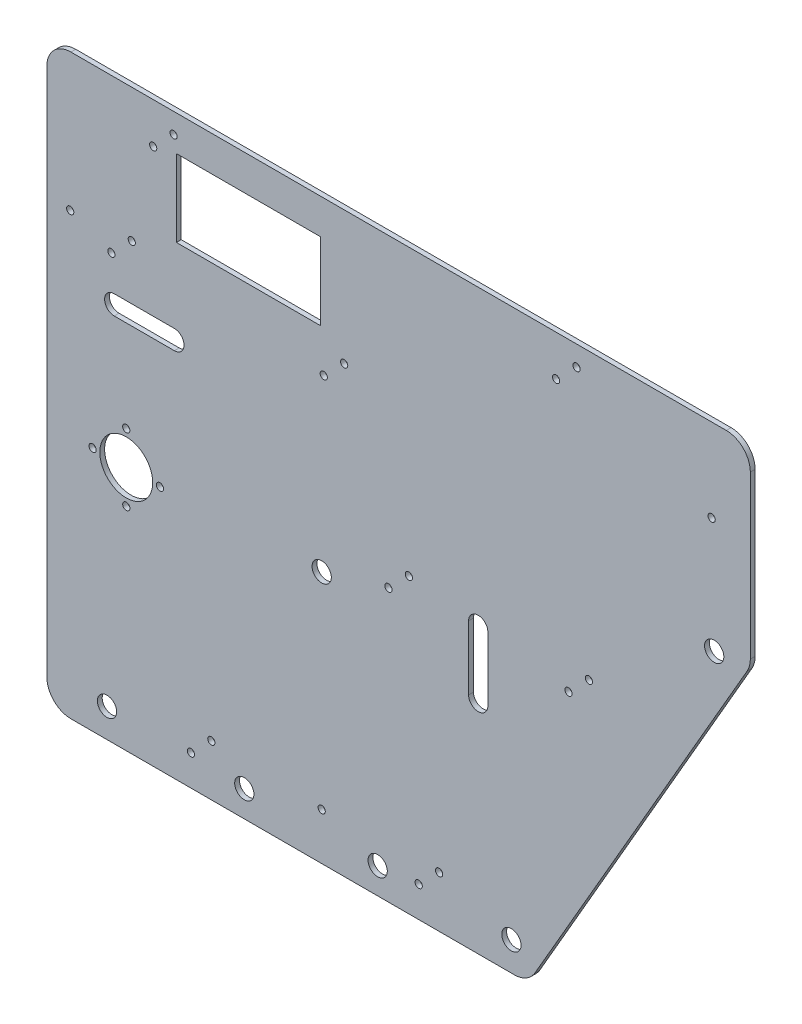
from build123d import *

# Parameters (mm, degrees)
SKETCH1_W           = 200
SKETCH1_H           = 160
SKETCH1_W_2         = 292.37604307
SKETCH1_H_2         = 30
BOSS_EXTRUDE1_DEPTH = 2
SKETCH2_R           = 4
SKETCH2_R_2         = 11
SKETCH2_R_3         = 1.5
CUT_EXTRUDE1_DEPTH  = 3
SKETCH4_W           = 292.37604307
SKETCH4_H           = 50
BOSS_EXTRUDE2_DEPTH = 2
FILLET1_R           = 10
SKETCH5_R           = 1.5
SKETCH5_W           = 60
SKETCH5_H           = 32
CUT_EXTRUDE2_DEPTH  = 11


with BuildPart() as part:
    # Sketch1 → Boss-Extrude1 (new body)
    with BuildSketch(Plane.XY):
        Rectangle(SKETCH1_W, SKETCH1_H)
        Polygon((192.37604307, 80), (100, -80), (100, 80), align=None)
        with Locations((46.188021535, 95)):
            Rectangle(SKETCH1_W_2, SKETCH1_H_2)
    extrude(amount=BOSS_EXTRUDE1_DEPTH)

    # Sketch2 → Cut-Extrude1 (cut)
    with BuildSketch(Plane.XY.offset(2)):
        with Locations((93.07179677, -68)):
            Circle(SKETCH2_R)
        with Locations((177.364936071, 78)):
            Circle(SKETCH2_R)
        with Locations((-67, 22)):
            Circle(SKETCH2_R_2)
        with Locations((-75, -68)):
            Circle(SKETCH2_R)
        with Locations((-53, 22)):
            Circle(SKETCH2_R_3)
        with Locations((-67, 36)):
            Circle(SKETCH2_R_3)
        with Locations((-81, 22)):
            Circle(SKETCH2_R_3)
        with Locations((-67, 8)):
            Circle(SKETCH2_R_3)
        with Locations((54.54952947, -67.242640687)):
            Circle(SKETCH2_R_3)
        with Locations((63.034810844, -58.757359313)):
            Circle(SKETCH2_R_3)
        with Locations((14.225855729, -60.5)):
            Circle(SKETCH2_R_3)
        with Locations((-40.127135228, -67.242640687)):
            Circle(SKETCH2_R_3)
        with Locations((-31.641853854, -58.757359313)):
            Circle(SKETCH2_R_3)
        with Locations((-90.295627115, 102.881439108)):
            Circle(SKETCH2_R_3)
        with Locations((-73.186266887, 96.138798421)):
            Circle(SKETCH2_R_3)
        with Locations((-64.700985513, 104.624079796)):
            Circle(SKETCH2_R_3)
        with Locations((15.078196993, 96.138798421)):
            Circle(SKETCH2_R_3)
        with Locations((23.563478368, 104.624079796)):
            Circle(SKETCH2_R_3)
        with Locations((41.969500075, 33.138798421)):
            Circle(SKETCH2_R_3)
        with Locations((50.454781449, 41.624079796)):
            Circle(SKETCH2_R_3)
        with Locations((116.811272287, 33.138798421)):
            Circle(SKETCH2_R_3)
        with Locations((125.296553661, 41.624079796)):
            Circle(SKETCH2_R_3)
        with Locations((14.225855729, 25)):
            Circle(SKETCH2_R)
        with Locations((176.305585362, 125.488938255)):
            Circle(SKETCH2_R_3)
        with Locations((-55.814717647, 143.138798421)):
            Circle(SKETCH2_R_3)
        with Locations((-47.329436273, 151.624079796)):
            Circle(SKETCH2_R_3)
        with Locations((111.655390934, 143.138798421)):
            Circle(SKETCH2_R_3)
        with Locations((120.140672308, 151.624079796)):
            Circle(SKETCH2_R_3)
        with Locations((-17.947932492, -69.117445741)):
            Circle(SKETCH2_R)
        with Locations((37.494421294, -69.117445741)):
            Circle(SKETCH2_R)
        with BuildLine():
            Line((75.290389443, 11.241781095), (75.290389443, 37.908558601))
            ThreePointArc((75.290389443, 37.908558601), (79.290389443, 41.908558601), (83.290389443, 37.908558601))
            Line((83.290389443, 37.908558601), (83.290389443, 11.241781095))
            ThreePointArc((83.290389443, 11.241781095), (79.290389443, 7.241781095), (75.290389443, 11.241781095))
        make_face()
        with BuildLine():
            Line((-72, 82), (-47, 82))
            ThreePointArc((-47, 82), (-43, 78), (-47, 74))
            Line((-47, 74), (-72, 74))
            ThreePointArc((-72, 74), (-76, 78), (-72, 82))
        make_face()
    extrude(amount=-CUT_EXTRUDE1_DEPTH, mode=Mode.SUBTRACT)

    # Sketch4 → Boss-Extrude2 (add)
    with BuildSketch(Plane.XY.offset(2)):
        with Locations((46.188021535, 135)):
            Rectangle(SKETCH4_W, SKETCH4_H)
    extrude(amount=-BOSS_EXTRUDE2_DEPTH)

    # Fillet1
    fillet1_edges = [part.edges().sort_by_distance(p)[0] for p in [
        (-100, 160, 1),
        (192.37604307, 160, 1),
        (-100, -80, 1),
        (192.37604307, 80, 1),
        (100, -80, 1),
    ]]
    fillet(fillet1_edges, radius=FILLET1_R)

    # Sketch5 → Cut-Extrude2 (cut)
    with BuildSketch(Plane.XY.offset(2)):
        with Locations((-55.814717647, 143.138798421)):
            Circle(SKETCH5_R)
        with Locations((-47.329436273, 151.624079796)):
            Circle(SKETCH5_R)
        with Locations((111.655390934, 143.138798421)):
            Circle(SKETCH5_R)
        with Locations((120.140672308, 151.624079796)):
            Circle(SKETCH5_R)
        with Locations((176.305585362, 125.488938255)):
            Circle(SKETCH5_R)
        with Locations((-16.178132997, 129.381439108)):
            Rectangle(SKETCH5_W, SKETCH5_H)
    extrude(amount=-CUT_EXTRUDE2_DEPTH, mode=Mode.SUBTRACT)


solid = part.part
